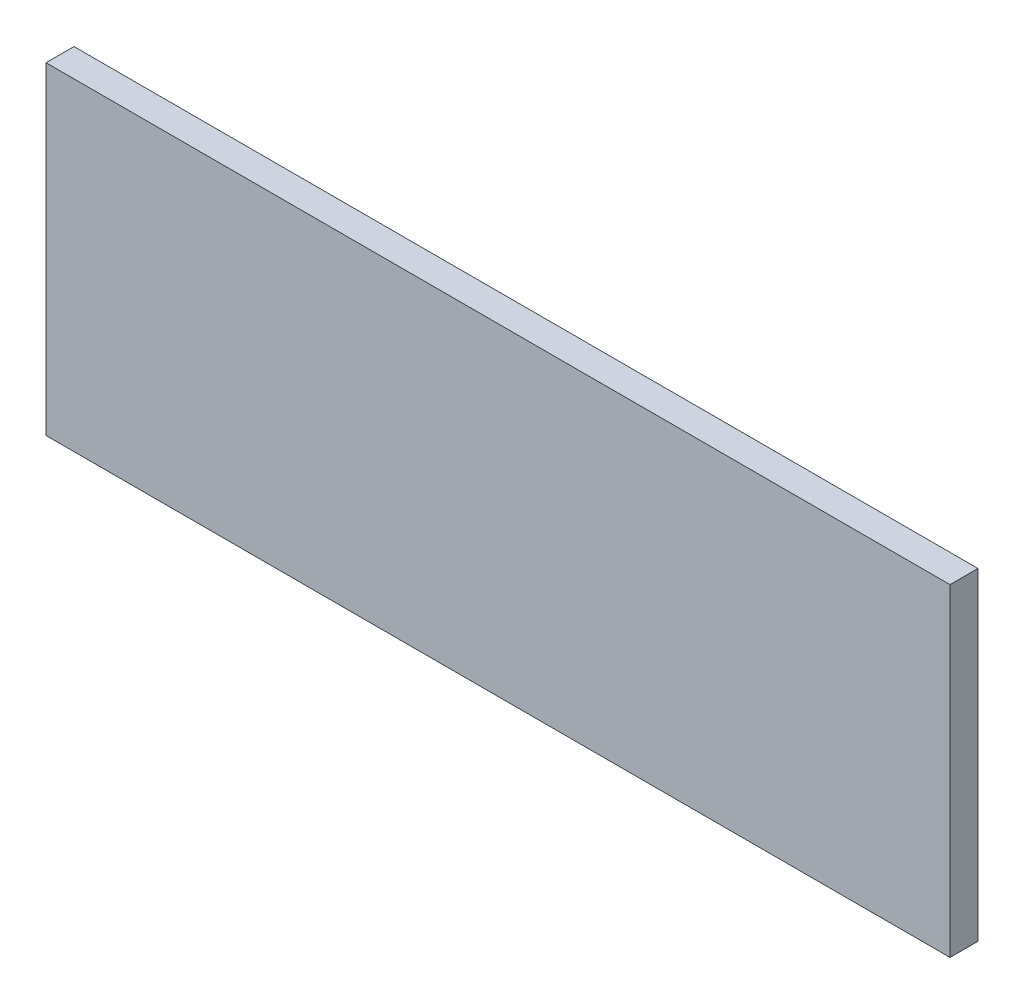
from build123d import *

# Parameters (mm, degrees)
SKETCH_1_W      = 420
SKETCH_1_H      = 150
EXTRUDE_1_DEPTH = 13


with BuildPart() as part:
    # ｽｹｯﾁ1 → ﾎﾞｽ - 押し出し1 (new body)
    with BuildSketch(Plane.XY):
        with Locations((140.719868277, 86.507142857)):
            Rectangle(SKETCH_1_W, SKETCH_1_H)
    extrude(amount=EXTRUDE_1_DEPTH)


solid = part.part
